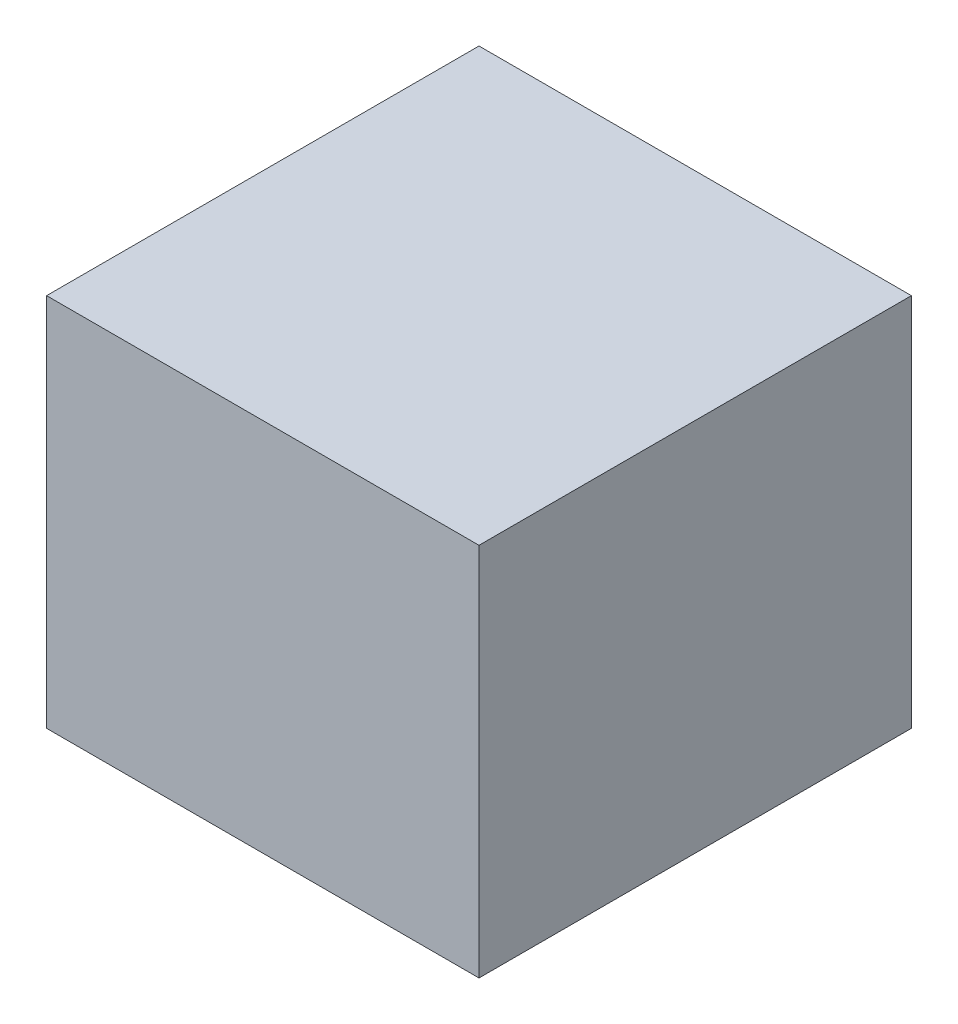
from build123d import *

# Parameters (mm, degrees)
SKETCH_1_W      = 75
SKETCH_1_H      = 75
EXTRUDE_1_DEPTH = 65


with BuildPart() as part:
    # 草图1 → 凸台-拉伸1 (new body)
    with BuildSketch(Plane(origin=(0, 0, 0), x_dir=(1, 0, 0), z_dir=(0, 1, 0))):
        Rectangle(SKETCH_1_W, SKETCH_1_H)
    extrude(amount=EXTRUDE_1_DEPTH)


solid = part.part
